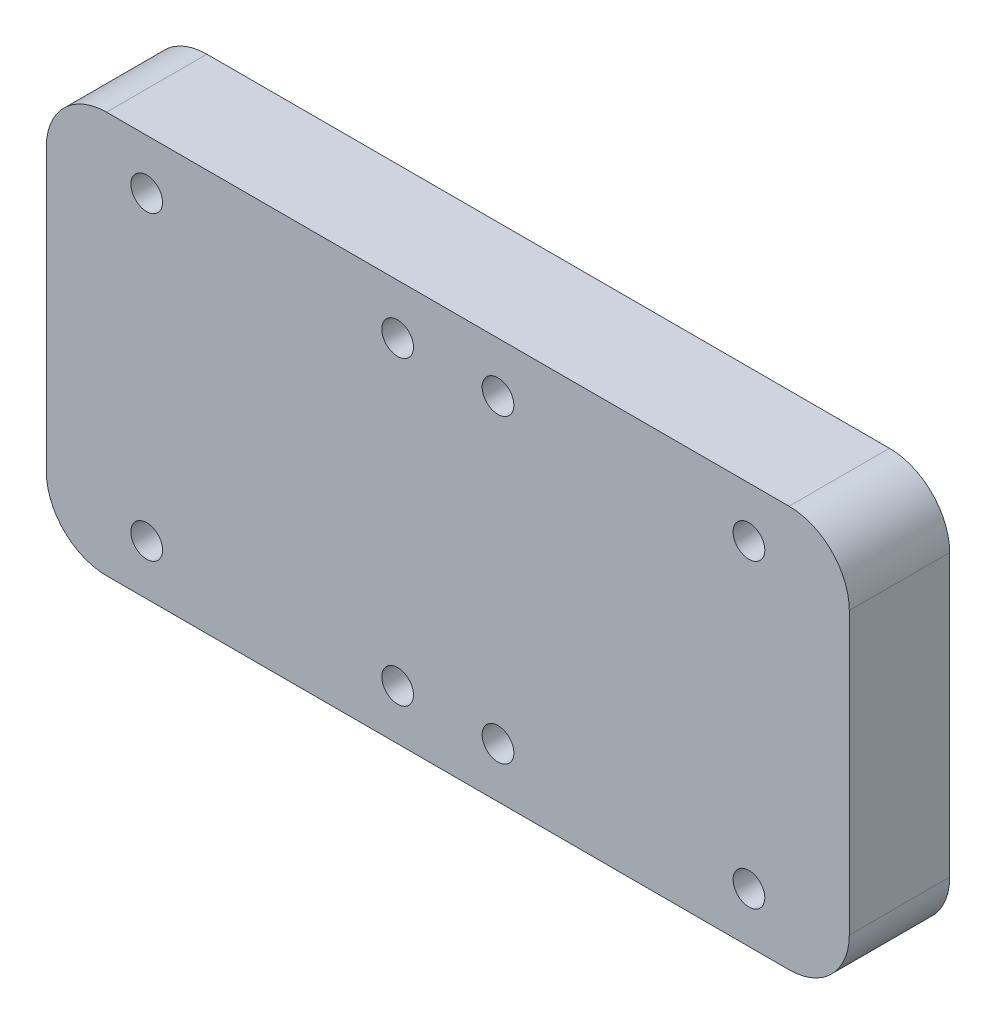
from build123d import *

# Parameters (mm, degrees)
ESQUISSE1_W             = 40
ESQUISSE1_H             = 20
BOSS_EXTRU_1_DEPTH      = 5
CONG_1_R                = 3
ESQUISSE2_R             = 0.79
ENL_V_MAT_EXTRU_1_DEPTH = 46


with BuildPart() as part:
    # Esquisse1 → Boss.-Extru.1 (new body)
    with BuildSketch(Plane.XY):
        with Locations((20, 10)):
            Rectangle(ESQUISSE1_W, ESQUISSE1_H)
    extrude(amount=BOSS_EXTRU_1_DEPTH)

    # Congé1
    cong_1_edges = [part.edges().sort_by_distance(p)[0] for p in [
        (0, 20, 2.5),
        (40, 20, 2.5),
        (40, 0, 2.5),
        (0, 0, 2.5),
    ]]
    fillet(cong_1_edges, radius=CONG_1_R)

    # Esquisse2 → Enlèv. mat.-Extru.1 (cut, through all)
    with BuildSketch(Plane.XY.offset(5)):
        with Locations((5, 17.5)):
            Circle(ESQUISSE2_R)
        with Locations((5, 2.5)):
            Circle(ESQUISSE2_R)
        with Locations((17.5, 2.5)):
            Circle(ESQUISSE2_R)
        with Locations((17.5, 17.5)):
            Circle(ESQUISSE2_R)
        with Locations(Location((22.5, 17.5, 0), (0, 0, 180))):
            Circle(ESQUISSE2_R)
        with Locations(Location((22.5, 2.5, 0), (0, 0, 180))):
            Circle(ESQUISSE2_R)
        with Locations(Location((35, 2.5, 0), (0, 0, 180))):
            Circle(ESQUISSE2_R)
        with Locations(Location((35, 17.5, 0), (0, 0, 180))):
            Circle(ESQUISSE2_R)
    extrude(amount=-ENL_V_MAT_EXTRU_1_DEPTH, mode=Mode.SUBTRACT)


solid = part.part
